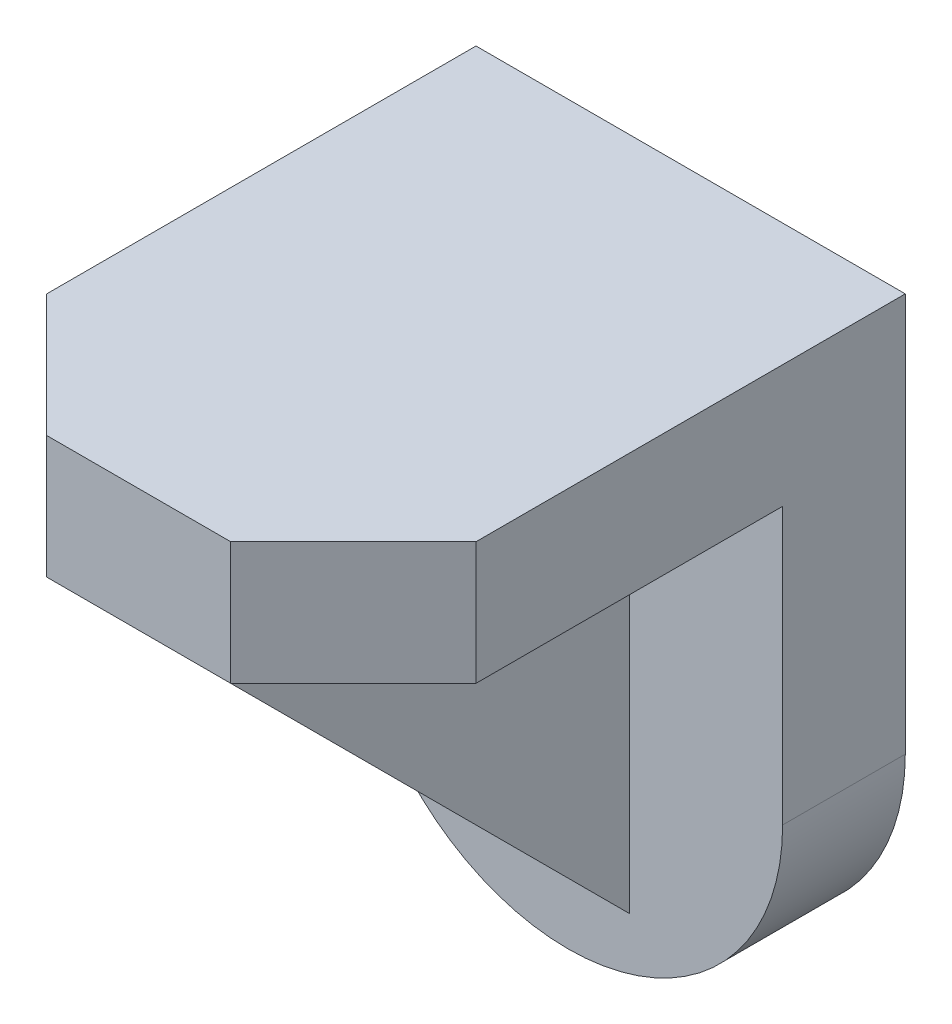
from build123d import *

# Parameters (mm, degrees)
SKETCH1_W           = 42
SKETCH1_H           = 54
BOSS_EXTRUDE1_DEPTH = 12
CHAMFER2_SIZE       = 12
BOSS_EXTRUDE2_DEPTH = 12
BOSS_EXTRUDE3_DEPTH = 6


with BuildPart() as part:
    # Sketch1 → Boss-Extrude1 (new body)
    with BuildSketch(Plane(origin=(0, 0, 0), x_dir=(1, 0, 0), z_dir=(0, 1, 0))):
        Rectangle(SKETCH1_W, SKETCH1_H)
    extrude(amount=BOSS_EXTRUDE1_DEPTH)

    # Chamfer2
    chamfer2_edges = [part.edges().sort_by_distance(p)[0] for p in [
        (21, 6, 27),
        (-21, 6, 27),
    ]]
    chamfer(chamfer2_edges, length=CHAMFER2_SIZE)

    # Sketch2 → Boss-Extrude2 (add)
    with BuildSketch(Plane(origin=(0, 0, -27), x_dir=(-1, 0, 0), z_dir=(0, 0, -1))):
        with BuildLine():
            Line((21, 0), (21, -27))
            ThreePointArc((21, -27), (0, -48), (-21, -27))
            Line((-21, -27), (-21, 0))
            Line((-21, 0), (21, 0))
        make_face()
    extrude(amount=-BOSS_EXTRUDE2_DEPTH)

    # Sketch8 → Boss-Extrude3 (add, symmetric)
    with BuildSketch(Plane(origin=(0, 0, 0), x_dir=(0, 0, -1), z_dir=(1, 0, 0))):
        Polygon((15, -42), (15, 0), (-27, 0), align=None)
    extrude(amount=BOSS_EXTRUDE3_DEPTH, both=True)


solid = part.part
